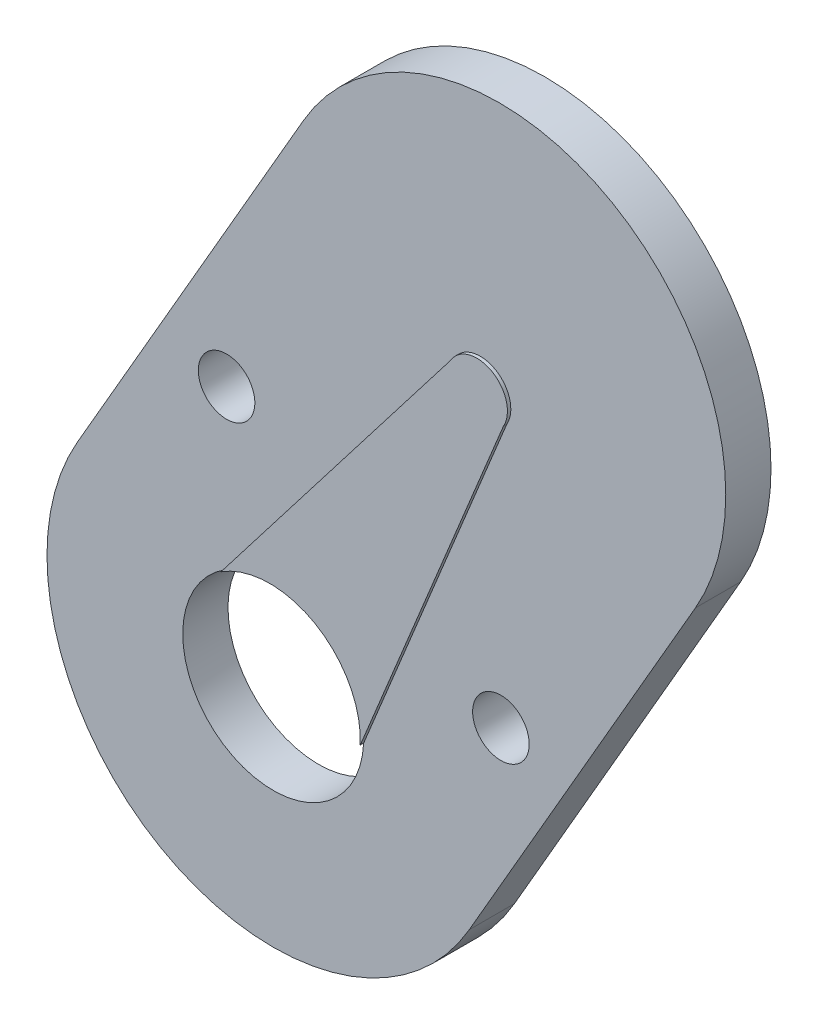
from build123d import *

# Parameters (mm, degrees)
RETAINER_PLATE_2MM_START         = -2
RETAINER_PLATE_2MM_DEPTH         = 2
RETAINER_PLATE_2MM_ROOT_START    = -2
SKETCH_2_R                       = 10
RETAINER_PLATE_2MM_ROOT_DEPTH    = 2
RETAINER_PLATE_2MM_TIP_START     = -2
SKETCH_3_R                       = 10
RETAINER_PLATE_2MM_TIP_DEPTH     = 2
HORN_CONTACT_PAD_0P15_DEPTH      = 0.15
SKETCH_5_R                       = 3.8
HORN_CONTACT_PAD_0P15_ROOT_DEPTH = 0.15
SKETCH_6_R                       = 1.35
HORN_CONTACT_PAD_0P15_TIP_DEPTH  = 0.15
BOSS_CLEARANCE_8_START           = -2.1
SKETCH_7_R                       = 4
BOSS_CLEARANCE_8_DEPTH           = 2.5
M2_CLEARANCE_2P5_PITCH14_START   = -2.1
SKETCH_8_R                       = 1.25
M2_CLEARANCE_2P5_PITCH14_DEPTH   = 2.5


with BuildPart() as part:
    # 草图1 → Retainer_plate_2mm (new body)
    with BuildSketch(Plane.XY.offset(RETAINER_PLATE_2MM_START)):
        Polygon((8.660254038, -5), (18.660254038, 12.320508076), (1.339745962, 22.320508076), (-8.660254038, 5), align=None)
    extrude(amount=RETAINER_PLATE_2MM_DEPTH)

    # 草图2 → Retainer_plate_2mm_root (add)
    with BuildSketch(Plane.XY.offset(RETAINER_PLATE_2MM_ROOT_START)):
        Circle(SKETCH_2_R)
    extrude(amount=RETAINER_PLATE_2MM_ROOT_DEPTH)

    # 草图3 → Retainer_plate_2mm_tip (add)
    with BuildSketch(Plane.XY.offset(RETAINER_PLATE_2MM_TIP_START)):
        with Locations((10, 17.320508076)):
            Circle(SKETCH_3_R)
    extrude(amount=RETAINER_PLATE_2MM_TIP_DEPTH)

    # 草图4 → Horn_contact_pad_0p15 (add)
    with BuildSketch(Plane.XY):
        Polygon((3.290896534, -1.9), (10.319134295, 15.173264889), (7.980865705, 16.523264889), (-3.290896534, 1.9), align=None)
    extrude(amount=HORN_CONTACT_PAD_0P15_DEPTH)

    # 草图5 → Horn_contact_pad_0p15_root (add)
    with BuildSketch(Plane.XY):
        Circle(SKETCH_5_R)
    extrude(amount=HORN_CONTACT_PAD_0P15_ROOT_DEPTH)

    # 草图6 → Horn_contact_pad_0p15_tip (add)
    with BuildSketch(Plane.XY):
        with Locations((9.15, 15.848264889)):
            Circle(SKETCH_6_R)
    extrude(amount=HORN_CONTACT_PAD_0P15_TIP_DEPTH)

    # 草图7 → Boss_clearance_8 (cut)
    with BuildSketch(Plane.XY.offset(BOSS_CLEARANCE_8_START)):
        with Locations(Location((0, 0, 0), (0, 0, 122.696435406))):
            Circle(SKETCH_7_R)
    extrude(amount=BOSS_CLEARANCE_8_DEPTH, mode=Mode.SUBTRACT)

    # 草图8 → M2_clearance_2p5_pitch14 (cut)
    with BuildSketch(Plane.XY.offset(M2_CLEARANCE_2P5_PITCH14_START)):
        with Locations((10.062177826, 3.42820323)):
            Circle(SKETCH_8_R)
        with Locations((-2.062177826, 10.42820323)):
            Circle(SKETCH_8_R)
    extrude(amount=M2_CLEARANCE_2P5_PITCH14_DEPTH, mode=Mode.SUBTRACT)


solid = part.part
